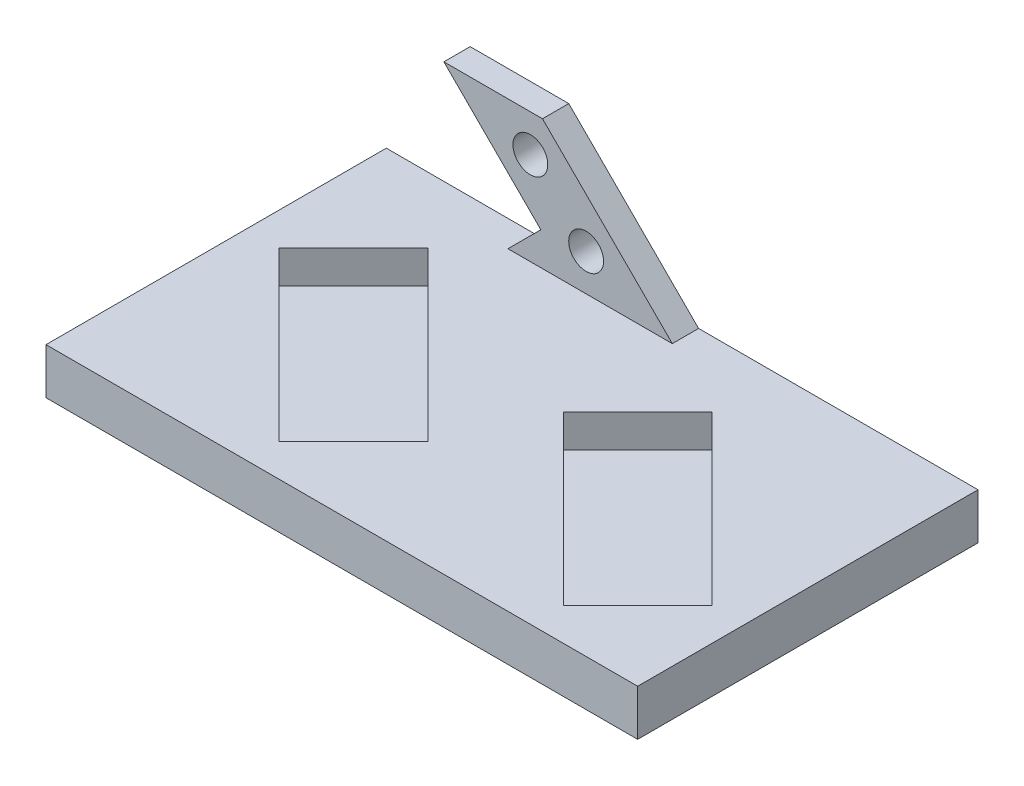
from build123d import *

# Parameters (mm, degrees)
SKETCH1_W           = 90
SKETCH1_H           = 51.769552622
BOSS_EXTRUDE1_DEPTH = 5
SKETCH5_R           = 2.65
BOSS_EXTRUDE2_DEPTH = 4
CHAMFER1_SIZE       = 10
CHAMFER1_SIZE2      = 7.071067812
SKETCH6_W           = 90
SKETCH6_H           = 51.769552622
BOSS_EXTRUDE3_DEPTH = 2


with BuildPart() as part:
    # Sketch1 → Boss-Extrude1 (new body)
    with BuildSketch(Plane(origin=(0, 0, 0), x_dir=(1, 0, 0), z_dir=(0, 1, 0))):
        with Locations((45, -25.884776311)):
            Rectangle(SKETCH1_W, SKETCH1_H)
        Polygon((5, -21.313708499), (30.455844123, -46.769552622), (41.769552622, -35.455844123), (16.313708499, -10), align=None, mode=Mode.SUBTRACT)
        Polygon((48.230447378, -21.313708499), (73.686291501, -46.769552622), (85, -35.455844123), (59.544155877, -10), align=None, mode=Mode.SUBTRACT)
    extrude(amount=BOSS_EXTRUDE1_DEPTH)

    # Sketch5 → Boss-Extrude2 (add)
    with BuildSketch(Plane(origin=(0, 0, 0), x_dir=(-1, 0, 0), z_dir=(0, 0, -1))):
        Polygon((-52.5, 0), (-27.751262658, 24.748737342), (-12.751262658, 24.748737342), (-37.5, 0), align=None)
        with Locations((-25.908116908, 19.091883092)):
            Circle(SKETCH5_R, mode=Mode.SUBTRACT)
        with Locations((-34.393398282, 10.606601718)):
            Circle(SKETCH5_R, mode=Mode.SUBTRACT)
    extrude(amount=-BOSS_EXTRUDE2_DEPTH)

    # Chamfer1
    chamfer1_edges = [part.edges().sort_by_distance(p)[0] for p in [
        (32.5, 5, 2),
    ]]
    chamfer1_side = [part.faces().sort_by_distance(p)[0] for p in [
        (45.087025644, 5, 25.465047734),
    ]]
    chamfer(chamfer1_edges, length=CHAMFER1_SIZE, length2=CHAMFER1_SIZE2, reference=chamfer1_side[0])

    # Sketch6 → Boss-Extrude3 (add)
    with BuildSketch(Plane.XZ):
        with Locations((45, 25.884776311)):
            Rectangle(SKETCH6_W, SKETCH6_H)
    extrude(amount=BOSS_EXTRUDE3_DEPTH)


solid = part.part
